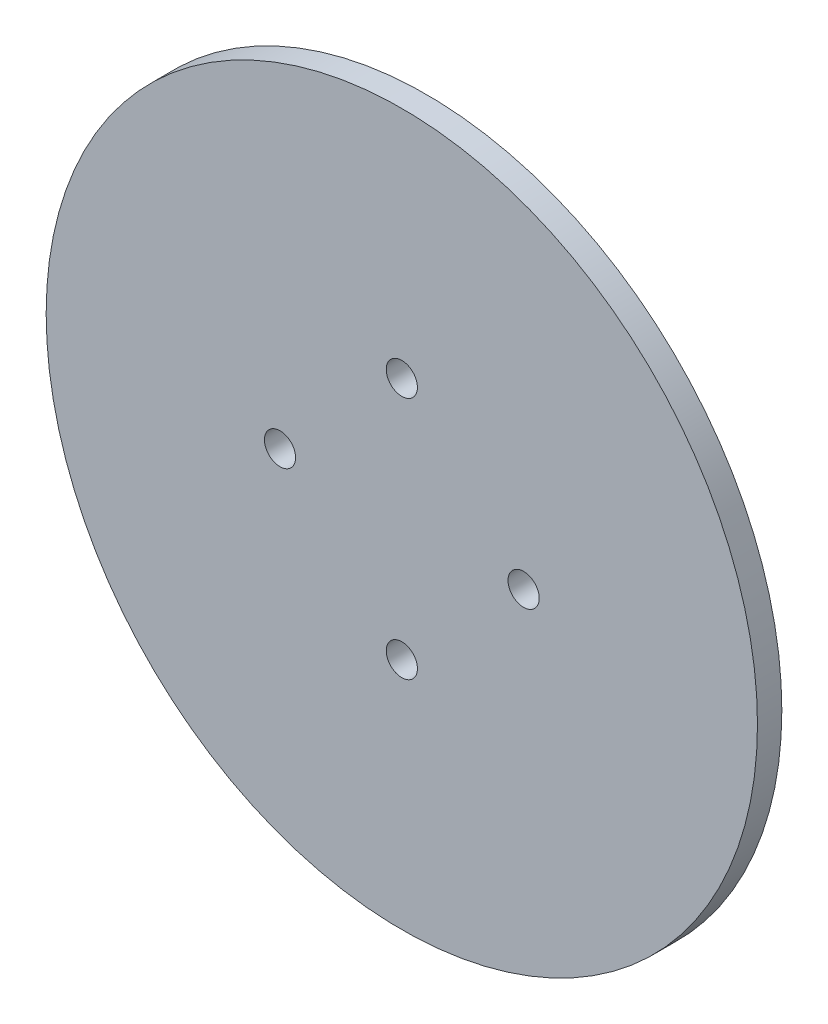
from build123d import *

# Parameters (mm, degrees)
SZKIC1_R                    = 73
SZKIC1_R_2                  = 3.2
DODANIE_WYCI_GNI_CIE1_DEPTH = 5


with BuildPart() as part:
    # Szkic1 → Dodanie-wyciągnięcie1 (new body)
    with BuildSketch(Plane.XY):
        Circle(SZKIC1_R)
        with Locations((0, 25)):
            Circle(SZKIC1_R_2, mode=Mode.SUBTRACT)
        with Locations((25, 0)):
            Circle(SZKIC1_R_2, mode=Mode.SUBTRACT)
        with Locations((0, -25)):
            Circle(SZKIC1_R_2, mode=Mode.SUBTRACT)
        with Locations((-25, 0)):
            Circle(SZKIC1_R_2, mode=Mode.SUBTRACT)
    extrude(amount=DODANIE_WYCI_GNI_CIE1_DEPTH)


solid = part.part
